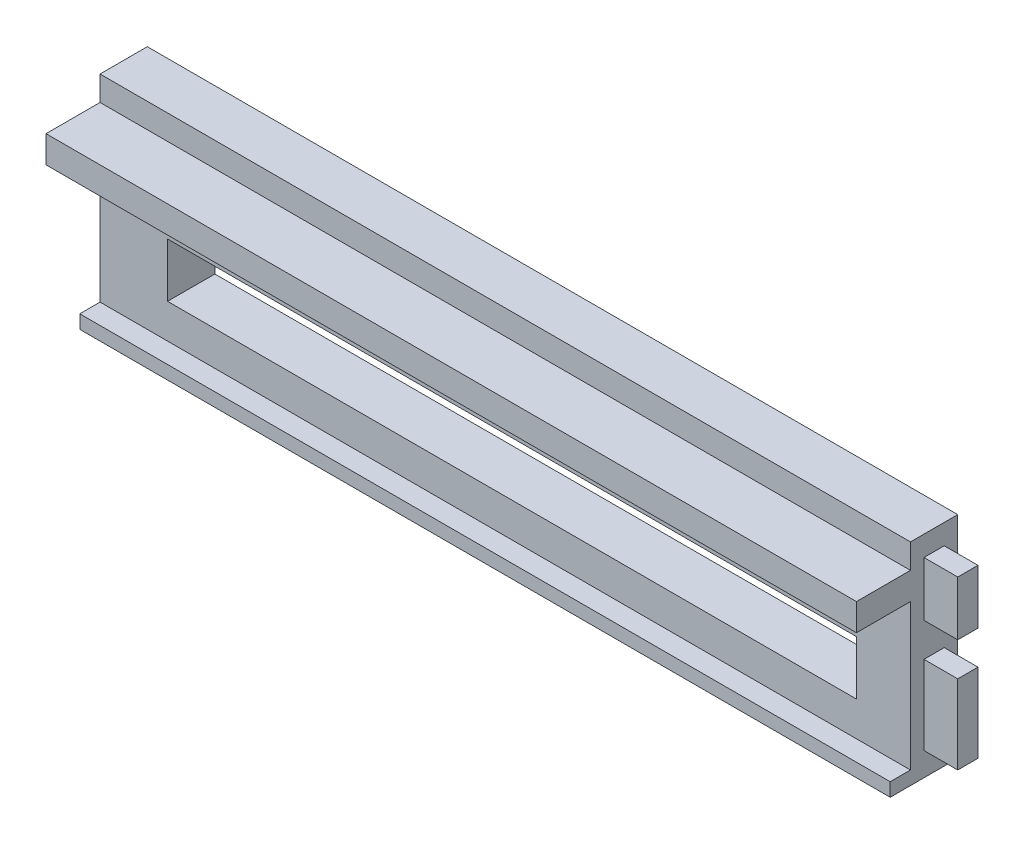
from build123d import *

# Parameters (mm, degrees)
SKETCH1_W               = 120
SKETCH1_H               = 31.25
BOSS_EXTRUDE1_DEPTH     = 7
SKETCH2_W               = 120
SKETCH2_H               = 4
SKETCH2_H_2             = 2
BOSS_EXTRUDE2_DEPTH     = 8
CUT_EXTRUDE1_DEPTH      = 125.260059955
CUT_EXTRUDE1_DEPTH_BACK = 125.260059955
SKETCH3_W               = 102
SKETCH3_H               = 8
SKETCH3_H_2             = 3.5
CUT_EXTRUDE3_REACH      = 126.906
SKETCH6_W               = 5
SKETCH6_H               = 2
SKETCH4_W               = 3
SKETCH4_H               = 8.090611825
SKETCH4_H_2             = 10.659388175
CUT_EXTRUDE4_DEPTH      = 5
SKETCH5_W               = 3
SKETCH5_H               = 8.0580149
SKETCH5_H_2             = 11.6919851
BOSS_EXTRUDE3_DEPTH     = 5


with BuildPart() as part:
    # Sketch1 → Boss-Extrude1 (new body)
    with BuildSketch(Plane.XY):
        with Locations((60, 15.625)):
            Rectangle(SKETCH1_W, SKETCH1_H)
    extrude(amount=BOSS_EXTRUDE1_DEPTH)

    # Sketch2 → Boss-Extrude2 (add)
    with BuildSketch(Plane.XY.offset(7)):
        with Locations((60, 25.6)):
            Rectangle(SKETCH2_W, SKETCH2_H)
        with Locations((60, 1)):
            Rectangle(SKETCH2_W, SKETCH2_H_2)
    extrude(amount=BOSS_EXTRUDE2_DEPTH)

    # Sketch3 → Cut-Extrude1 (cut, two sides: drawn at the far end of the back side and taken through both)
    with BuildSketch(Plane.XY.offset(7).offset(-CUT_EXTRUDE1_DEPTH_BACK)):
        with Locations((61, 11.1)):
            Rectangle(SKETCH3_W, SKETCH3_H)
        with Locations((61, 21.85)):
            Rectangle(SKETCH3_W, SKETCH3_H_2)
    extrude(amount=CUT_EXTRUDE1_DEPTH + CUT_EXTRUDE1_DEPTH_BACK, mode=Mode.SUBTRACT)

    # Sketch6 → Cut-Extrude3 (cut, up to next)
    with BuildSketch(Plane.ZY, mode=Mode.PRIVATE) as cut_extrude3_sk1:
        with Locations((12.5, 1)):
            Rectangle(SKETCH6_W, SKETCH6_H)
    cut_extrude3_tool1 = extrude(cut_extrude3_sk1.sketch, amount=-CUT_EXTRUDE3_REACH, mode=Mode.PRIVATE) & part.part
    add(cut_extrude3_tool1.solids().sort_by_distance((0, 1, 12.5))[0], mode=Mode.SUBTRACT)

    # Sketch4 → Cut-Extrude4 (cut)
    with BuildSketch(Plane.ZY):
        with Locations((3.5, 24.204694088)):
            Rectangle(SKETCH4_W, SKETCH4_H)
        with Locations((3.5, 8.829694088)):
            Rectangle(SKETCH4_W, SKETCH4_H_2)
    extrude(amount=-CUT_EXTRUDE4_DEPTH, mode=Mode.SUBTRACT)

    # Sketch5 → Boss-Extrude3 (add)
    with BuildSketch(Plane(origin=(120, 0, 0), x_dir=(0, 0, -1), z_dir=(1, 0, 0))):
        with Locations((-3.5, 24.22099255)):
            Rectangle(SKETCH5_W, SKETCH5_H)
        with Locations((-3.5, 9.34599255)):
            Rectangle(SKETCH5_W, SKETCH5_H_2)
    extrude(amount=BOSS_EXTRUDE3_DEPTH)


solid = part.part
